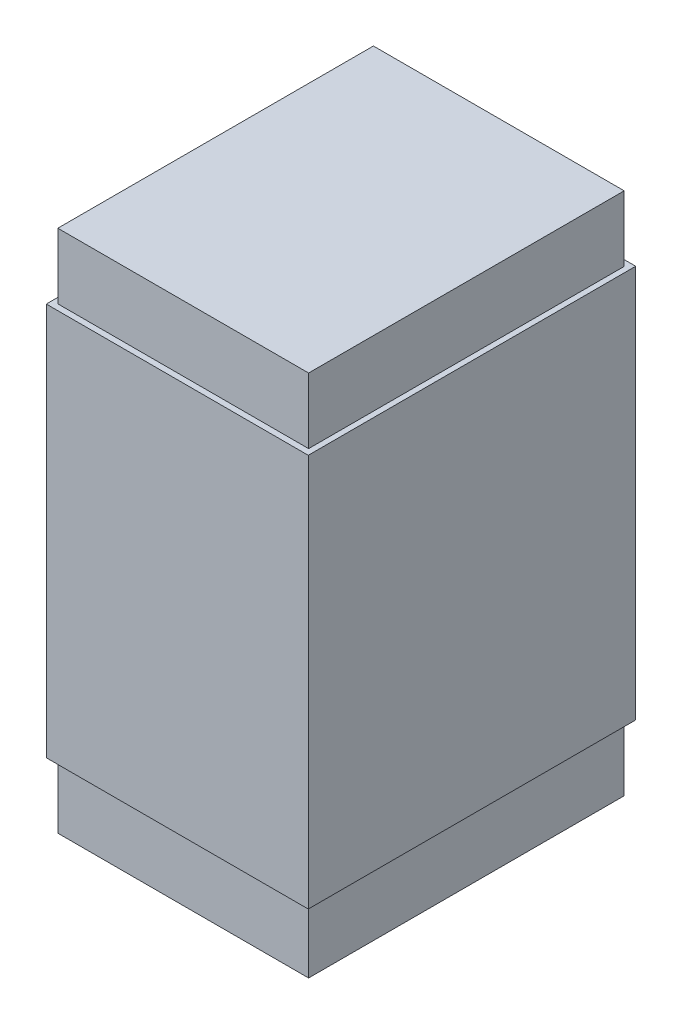
from build123d import *

# Parameters (mm, degrees)
SKETCH1_W           = 0.8
SKETCH1_H           = 1
BOSS_EXTRUDE1_DEPTH = 1.2
SKETCH2_W           = 0.765895346
SKETCH2_H           = 0.963720624
BOSS_EXTRUDE2_DEPTH = 0.2
SKETCH3_W           = 0.765895346
SKETCH3_H           = 0.963720624
BOSS_EXTRUDE3_DEPTH = 0.2


with BuildPart() as part:
    # Sketch1 → Boss-Extrude1 (new body)
    with BuildSketch(Plane(origin=(0, 0, 0), x_dir=(1, 0, 0), z_dir=(0, 1, 0))):
        Rectangle(SKETCH1_W, SKETCH1_H)
    extrude(amount=BOSS_EXTRUDE1_DEPTH)

    # Sketch2 → Boss-Extrude2 (add)
    with BuildSketch(Plane(origin=(0, 1.2, 0), x_dir=(1, 0, 0), z_dir=(0, 1, 0))):
        Rectangle(SKETCH2_W, SKETCH2_H)
    extrude(amount=BOSS_EXTRUDE2_DEPTH)

    # Sketch3 → Boss-Extrude3 (add)
    with BuildSketch(Plane.XZ):
        Rectangle(SKETCH3_W, SKETCH3_H)
    extrude(amount=BOSS_EXTRUDE3_DEPTH)


solid = part.part
